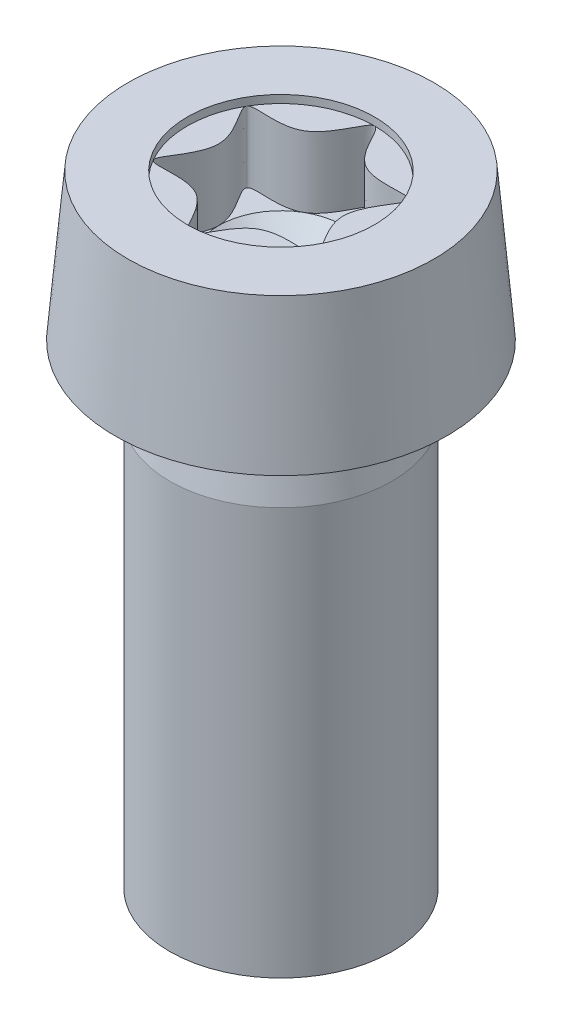
from build123d import *

# Parameters (mm, degrees)
FILLET1_R                 = 0.2
SOCKET_CUT_EXTRUDE1_DEPTH = 1.66
SKETCH3_R                 = 1.975
SOCKET_CUT_EXTRUDE2_DEPTH = 0.166


with BuildPart() as part:
    # Sketch1 → Body-Revolve (revolve)
    with BuildSketch(Plane.XY, mode=Mode.PRIVATE) as body_revolve_sk:
        Polygon((0, 13.1), (3.228785143, 13.1), (3.5, 10), (2.35, 10), (2.07, 10), (2.35, 8.6), (2.35, 0), (0, 0), align=None)
    revolve(body_revolve_sk.sketch.rotate(Axis((0, 0, 0), (0, 1, 0)), 90), axis=Axis((0, 0, 0), (0, 1, 0)))

    # Fillet1
    fillet1_edges = [part.edges().sort_by_distance(p)[0] for p in [
        (0, 10, 2.07),
    ]]
    fillet(fillet1_edges, radius=FILLET1_R)

    # Sketch2 → Socket-Cut-Extrude1 (cut)
    with BuildSketch(Plane(origin=(0, 13.1, 0), x_dir=(-1, 0, 0), z_dir=(0, 1, 0))):
        with BuildLine():
            add(Edge.make_bspline(
                [(0, -1.975), (-0.141989717, -1.975), (-0.425969151, -0.737800212), (-2.246123395, -1.296799947), (-0.851938302, 0), (-2.246123395, 1.296799947), (-0.425969151, 0.737800212), (0, 2.593599894), (0.425969151, 0.737800212), (2.246123395, 1.296799947), (0.851938302, 0), (2.246123395, -1.296799947), (0.425969151, -0.737800212), (0.141989717, -1.975), (0, -1.975)],
                knots=[0, 0, 0, 0, 0.083333333, 0.166666667, 0.25, 0.333333333, 0.416666667, 0.5, 0.583333333, 0.666666667, 0.75, 0.833333333, 0.916666667, 1, 1, 1, 1], degree=3))
        make_face()
    extrude(amount=-SOCKET_CUT_EXTRUDE1_DEPTH, mode=Mode.SUBTRACT)

    # Sketch3 → Socket-Cut-Extrude2 (cut)
    with BuildSketch(Plane(origin=(0, 13.1, 0), x_dir=(-1, 0, 0), z_dir=(0, 1, 0))):
        with Locations(Location((0, 0, 0), (0, 0, 90))):
            Circle(SKETCH3_R)
    extrude(amount=-SOCKET_CUT_EXTRUDE2_DEPTH, mode=Mode.SUBTRACT)

    # Sketch4 → Drill-Cut-Revolve (revolve, cut)
    with BuildSketch(Plane.XY, mode=Mode.PRIVATE) as drill_cut_revolve_sk:
        Polygon((0, 11.44), (1.316666667, 11.44), (0, 10.31), align=None)
    revolve(drill_cut_revolve_sk.sketch.rotate(Axis((0, 0, 0), (0, 1, 0)), 270), axis=Axis((0, 0, 0), (0, 1, 0)), mode=Mode.SUBTRACT)


solid = part.part
